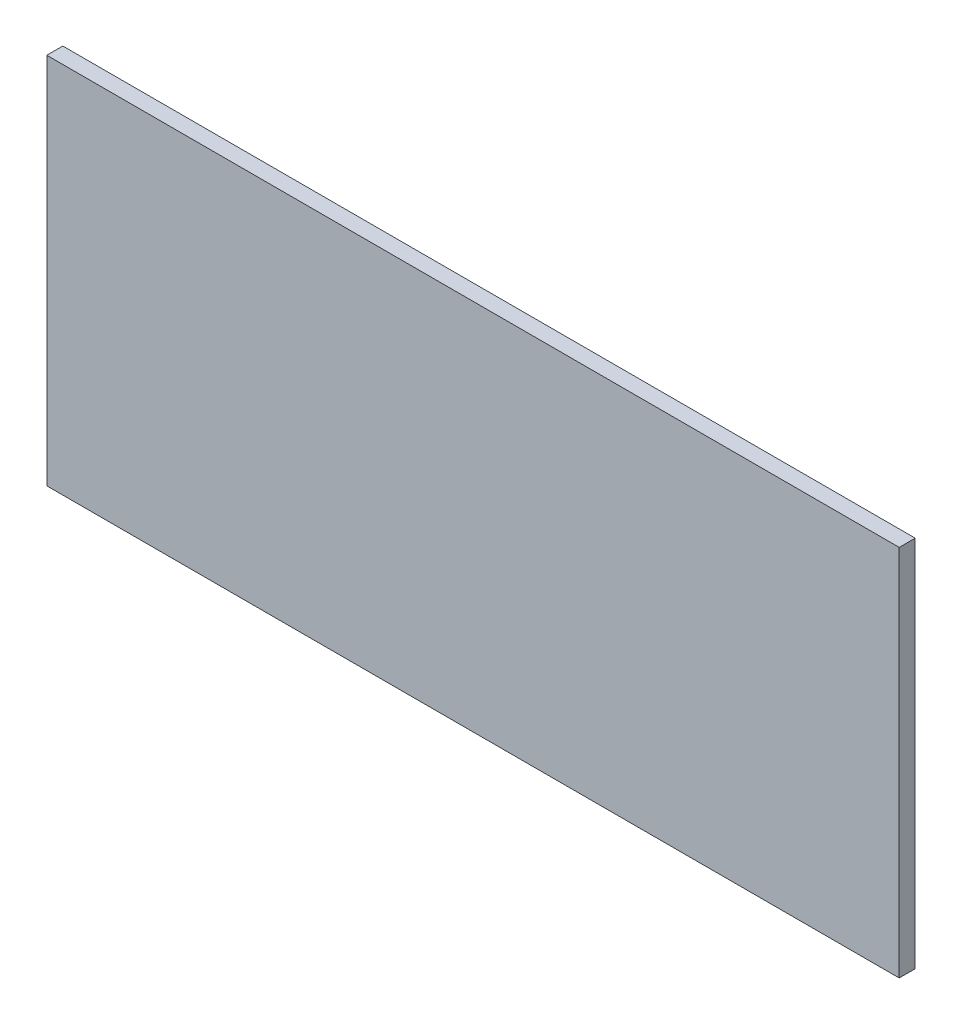
from build123d import *

# Parameters (mm, degrees)
SKETCH1_W           = 160
SKETCH1_H           = 70
BOSS_EXTRUDE1_DEPTH = 3


with BuildPart() as part:
    # Sketch1 → Boss-Extrude1 (new body)
    with BuildSketch(Plane.XY):
        with Locations((-80, 35)):
            Rectangle(SKETCH1_W, SKETCH1_H)
    extrude(amount=BOSS_EXTRUDE1_DEPTH)


solid = part.part
